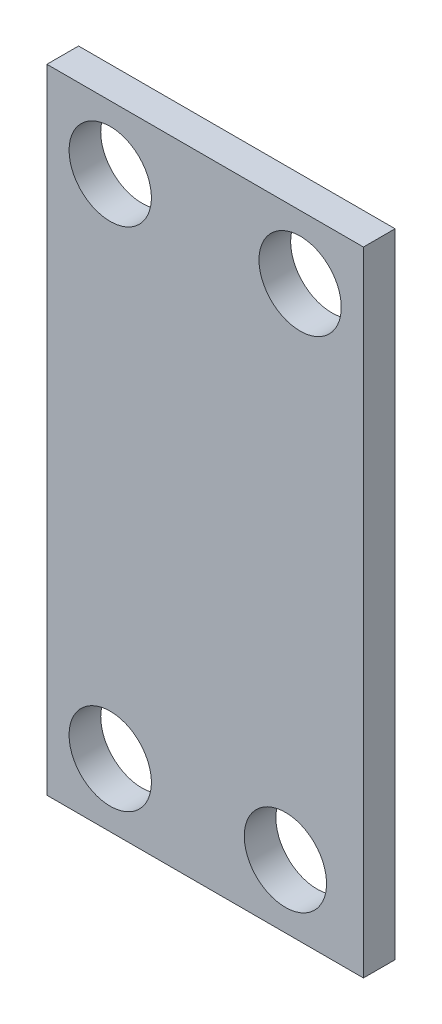
from build123d import *

# Parameters (mm, degrees)
SKETCH1_W           = 50
SKETCH1_H           = 100
BOSS_EXTRUDE1_DEPTH = 5
SKETCH2_R           = 6.5
CUT_EXTRUDE1_DEPTH  = 112.915146428


with BuildPart() as part:
    # Sketch1 → Boss-Extrude1 (new body)
    with BuildSketch(Plane.XY):
        with Locations((25, -50)):
            Rectangle(SKETCH1_W, SKETCH1_H)
    extrude(amount=BOSS_EXTRUDE1_DEPTH)

    # Sketch2 → Cut-Extrude1 (cut, through all)
    with BuildSketch(Plane(origin=(0, 0, 0), x_dir=(-1, 0, 0), z_dir=(0, 0, -1))):
        with Locations((-10, -10)):
            Circle(SKETCH2_R)
        with Locations((-40, -10)):
            Circle(SKETCH2_R)
        with Locations((-10, -90)):
            Circle(SKETCH2_R)
        with Locations((-37.674641047, -90)):
            Circle(SKETCH2_R)
    extrude(amount=-CUT_EXTRUDE1_DEPTH, mode=Mode.SUBTRACT)


solid = part.part
